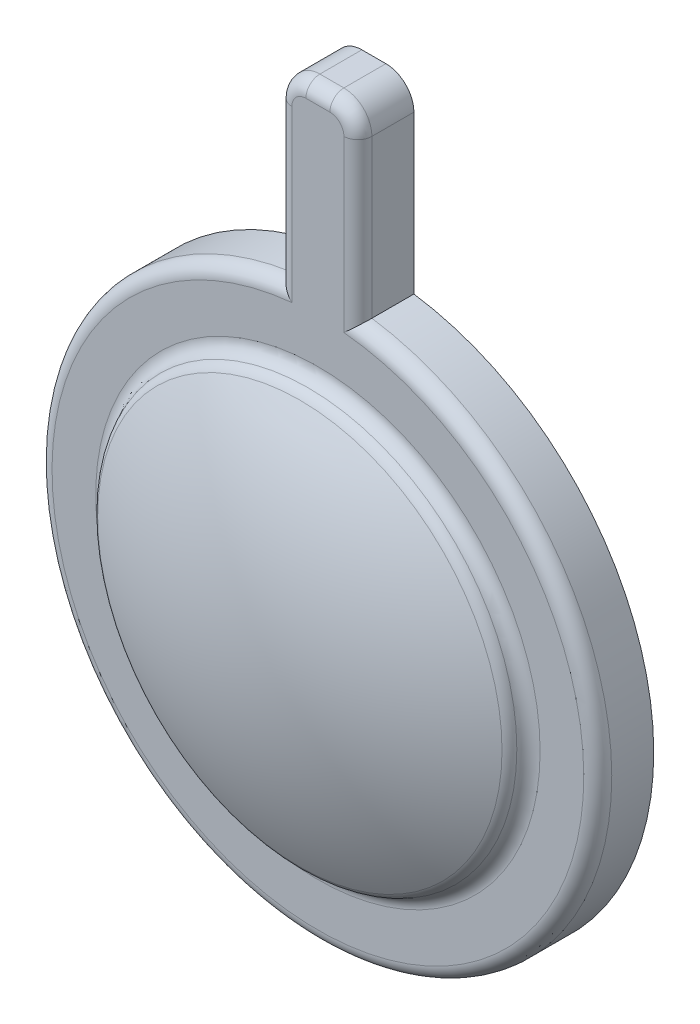
from build123d import *

# Parameters (mm, degrees)
ESQUISSE1_R             = 20
BOSS_EXTRU_1_DEPTH      = 4
ESQUISSE4_R             = 4
BOSS_EXTRU_3_DEPTH      = 6.843
BOSS_EXTRU_4_DEPTH      = 4
ESQUISSE6_R             = 1.5
ENL_V_MAT_EXTRU_1_DEPTH = 2.1
ESQUISSE7_R             = 1.5
BOSS_EXTRU_5_DEPTH      = 1
ESQUISSE8_R             = 4.2
BOSS_EXTRU_6_DEPTH      = 6.843
ESQUISSE9_R             = 14.967417913
BOSS_EXTRU_7_DEPTH      = 1
D_ME1_FACE_RADIUS       = 14.967417913
D_ME1_HEIGHT            = 4
CONG_1_R                = 1
CONG_2_R                = 1
CONG_3_R                = 1


with BuildPart() as part:
    # Esquisse1 → Boss.-Extru.1 (new body)
    with BuildSketch(Plane.XY):
        Circle(ESQUISSE1_R)
    extrude(amount=BOSS_EXTRU_1_DEPTH)

    # Esquisse4 → Boss.-Extru.3 (add)
    with BuildSketch(Plane(origin=(0, 0, 0), x_dir=(-1, 0, 0), z_dir=(0, 0, -1))):
        with Locations(Location((0, 0, 0), (0, 0, 180))):
            Circle(ESQUISSE4_R)
    extrude(amount=BOSS_EXTRU_3_DEPTH)

    # Esquisse5 → Boss.-Extru.4 (add)
    with BuildSketch(Plane(origin=(0, 0, 0), x_dir=(-1, 0, 0), z_dir=(0, 0, -1))):
        with BuildLine():
            Line((2.858287427, 14.40822907), (-2.858287427, 14.40822907))
            Line((-2.858287427, 14.40822907), (-2.858287427, 31.050344996))
            ThreePointArc((-2.858287427, 31.050344996), (-2.27250099, 32.464558559), (-0.858287427, 33.050344996))
            Line((-0.858287427, 33.050344996), (0.858287427, 33.050344996))
            ThreePointArc((0.858287427, 33.050344996), (2.27250099, 32.464558559), (2.858287427, 31.050344996))
            Line((2.858287427, 31.050344996), (2.858287427, 14.40822907))
        make_face()
    extrude(amount=-BOSS_EXTRU_4_DEPTH)

    # Esquisse6 → Enlèv. mat.-Extru.1 (cut)
    with BuildSketch(Plane(origin=(0, 0, 0), x_dir=(-1, 0, 0), z_dir=(0, 0, -1))):
        with Locations((0, 28.410842354)):
            Circle(ESQUISSE6_R)
    extrude(amount=-ENL_V_MAT_EXTRU_1_DEPTH, mode=Mode.SUBTRACT)

    # Esquisse7 → Boss.-Extru.5 (add)
    with BuildSketch(Plane(origin=(0, 0, 0), x_dir=(-1, 0, 0), z_dir=(0, 0, -1))):
        with Locations(Location((0, -15.504004846, 0), (0, 0, 180))):
            Circle(ESQUISSE7_R)
    extrude(amount=BOSS_EXTRU_5_DEPTH)

    # Esquisse8 → Boss.-Extru.6 (add)
    with BuildSketch(Plane(origin=(0, 0, 0), x_dir=(-1, 0, 0), z_dir=(0, 0, -1))):
        with Locations(Location((0, 0, 0), (0, 0, 180))):
            Circle(ESQUISSE8_R)
    extrude(amount=BOSS_EXTRU_6_DEPTH)

    # Esquisse9 → Boss.-Extru.7 (add)
    with BuildSketch(Plane.XY.offset(4)):
        Circle(ESQUISSE9_R)
    extrude(amount=BOSS_EXTRU_7_DEPTH)

    # Dôme1: a dome of height H over a round flat face of radius A is a cap of a sphere of radius (A * A + H * H) / (2 * H)
    d_me1_r = (D_ME1_FACE_RADIUS * D_ME1_FACE_RADIUS + D_ME1_HEIGHT * D_ME1_HEIGHT) / (2 * D_ME1_HEIGHT)
    d_me1_base = Plane((0, 0, 5), z_dir=(0, 0, 1))
    with Locations(d_me1_base.offset(D_ME1_HEIGHT - d_me1_r)):
        d_me1_ball = Sphere(d_me1_r, mode=Mode.PRIVATE)
    add(split(d_me1_ball, bisect_by=d_me1_base, keep=Keep.TOP, mode=Mode.PRIVATE))

    # Congé1
    cong_1_edges = [part.edges().sort_by_distance(p)[0] for p in [
        (-14.967417913, 0, 5),
    ]]
    fillet(cong_1_edges, radius=CONG_1_R)

    # Congé2
    cong_2_edges = [part.edges().sort_by_distance(p)[0] for p in [
        (-14.967417913, 0, 4),
    ]]
    fillet(cong_2_edges, radius=CONG_2_R)

    # Congé3
    cong_3_edges = [part.edges().sort_by_distance(p)[0] for p in [
        (0, -20, 4),
        (-2.858287427, 25.422523065, 4),
        (2.858287427, 25.422523065, 4),
        (2.27250099, 32.464558559, 4),
        (0, 33.050344996, 4),
        (-2.27250099, 32.464558559, 4),
    ]]
    fillet(cong_3_edges, radius=CONG_3_R)


solid = part.part
